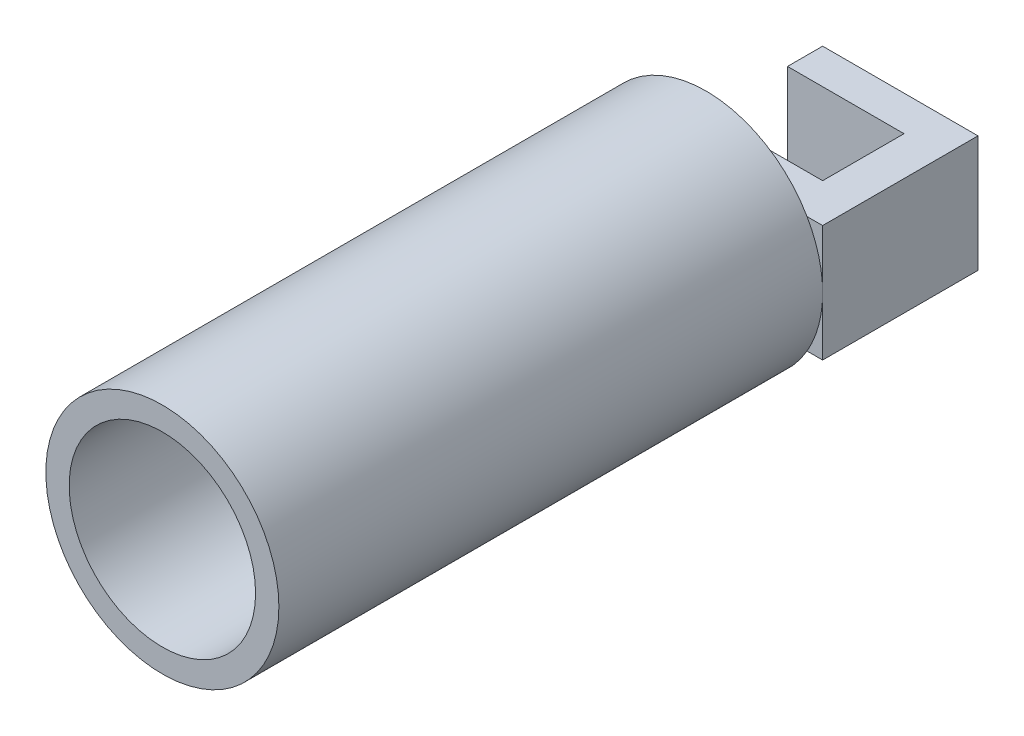
from build123d import *

# Parameters (mm, degrees)
ESQUISSE1_R             = 15
BOSS_EXTRU_1_DEPTH      = 70
ESQUISSE2_R             = 12
ENL_V_MAT_EXTRU_1_DEPTH = 65
ESQUISSE3_W             = 5
ESQUISSE3_H             = 15
BOSS_EXTRU_2_DEPTH      = 5
ESQUISSE12_W            = 5
ESQUISSE12_H            = 15
BOSS_EXTRU_6_DEPTH      = 10
ESQUISSE13_W            = 5
ESQUISSE13_H            = 15
BOSS_EXTRU_7_DEPTH      = 15
ESQUISSE14_W            = 4.52084763
ESQUISSE14_H            = 15
BOSS_EXTRU_8_DEPTH      = 15


with BuildPart() as part:
    # Esquisse1 → Boss.-Extru.1 (new body)
    with BuildSketch(Plane.XY):
        Circle(ESQUISSE1_R)
    extrude(amount=BOSS_EXTRU_1_DEPTH)

    # Esquisse2 → Enlèv. mat.-Extru.1 (cut)
    with BuildSketch(Plane.XY.offset(70)):
        Circle(ESQUISSE2_R)
    extrude(amount=-ENL_V_MAT_EXTRU_1_DEPTH, mode=Mode.SUBTRACT)

    # Esquisse3 → Boss.-Extru.2 (add)
    with BuildSketch(Plane(origin=(0, 0, 0), x_dir=(-1, 0, 0), z_dir=(0, 0, -1))):
        with Locations((-2.5, 0)):
            Rectangle(ESQUISSE3_W, ESQUISSE3_H)
    extrude(amount=BOSS_EXTRU_2_DEPTH)

    # Esquisse12 → Boss.-Extru.6 (add)
    with BuildSketch(Plane(origin=(5, 0, 0), x_dir=(0, 0, -1), z_dir=(1, 0, 0))):
        with Locations((2.5, 0)):
            Rectangle(ESQUISSE12_W, ESQUISSE12_H)
    extrude(amount=BOSS_EXTRU_6_DEPTH)

    # Esquisse13 → Boss.-Extru.7 (add)
    with BuildSketch(Plane(origin=(0, 0, -5), x_dir=(-1, 0, 0), z_dir=(0, 0, -1))):
        with Locations((-12.5, 0)):
            Rectangle(ESQUISSE13_W, ESQUISSE13_H)
    extrude(amount=BOSS_EXTRU_7_DEPTH)

    # Esquisse14 → Boss.-Extru.8 (add)
    with BuildSketch(Plane.ZY.offset(-10)):
        with Locations((-17.739576185, 0)):
            Rectangle(ESQUISSE14_W, ESQUISSE14_H)
    extrude(amount=BOSS_EXTRU_8_DEPTH)


solid = part.part
